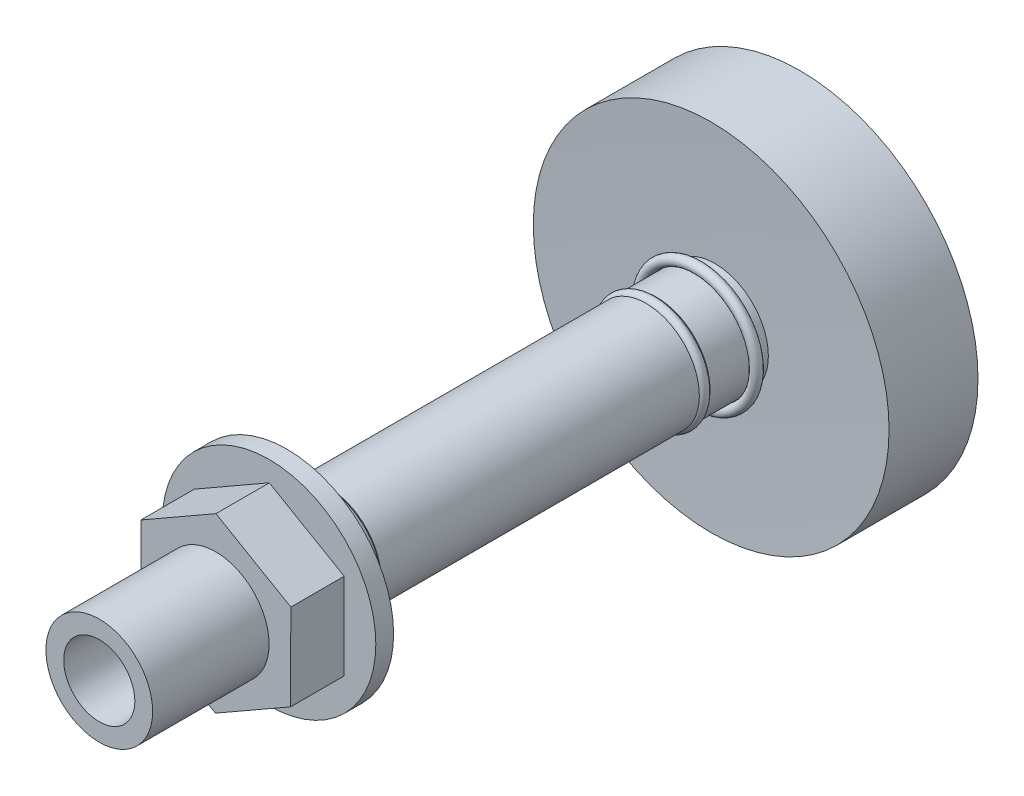
from build123d import *

# Parameters (mm, degrees)
SKETCH3_W          = 5
SKETCH3_H          = 12
SKETCH4_W          = 2
SKETCH4_H          = 3
SKETCH4_W_2        = 3
SKETCH4_H_2        = 2
SKETCH5_R          = 1.4
SKETCH6_R          = 30
CUT_EXTRUDE1_DEPTH = 15


with BuildPart() as part:
    # Sketch2 → Revolve1 (revolve)
    with BuildSketch(Plane(origin=(0, 0, 0), x_dir=(0, 0, -1), z_dir=(1, 0, 0)), mode=Mode.PRIVATE) as revolve1_sk:
        with BuildLine():
            Line((-102.306070176, 10), (-68.687078277, 10))
            Line((-68.687078277, 10), (-54.196133493, 10))
            Line((-54.196133493, 10), (-54.196133493, 5.2))
            Line((-54.196133493, 5.2), (54.694863194, 5.2))
            Line((54.694863194, 5.2), (54.694863194, 10))
            Line((54.694863194, 10), (94.694863194, 10))
            Line((94.694863194, 10), (94.694863194, 15))
            Line((94.694863194, 15), (70.768627771, 15))
            Line((70.768627771, 15), (-49.231372229, 15))
            ThreePointArc((-49.231372229, 15), (-49.372037195, 22.50063316), (-49.568967196, 30))
            Line((-49.568967196, 30), (-69.568967196, 30))
            Line((-69.568967196, 30), (-69.568967196, 15))
            Line((-69.568967196, 15), (-102.306070176, 15))
            Line((-102.306070176, 15), (-102.306070176, 10))
        make_face()
        with BuildLine():
            Line((70.768627771, 15), (94.694863194, 15))
            Line((94.694863194, 15), (94.694863194, 50))
            Line((94.694863194, 50), (69.694863194, 50))
            ThreePointArc((69.694863194, 50), (70.376280854, 32.504434199), (70.768627771, 15))
        make_face()
    revolve(revolve1_sk.sketch.rotate(Axis((0, 0, 82.888204165), (0, 0, -1)), 90), axis=Axis((0, 0, 82.888204165), (0, 0, -1)))

    # Sketch4 → Cut-Revolve1 (revolve, cut)
    with BuildSketch(Plane(origin=(0, 0, 0), x_dir=(1, 0, 0), z_dir=(0, 1, 0)), mode=Mode.PRIVATE) as cut_revolve1_sk:
        Polygon((5.184385657, 46.135301631), (7.184385374, 46.134238031), (7.184385374, 43.134238031), (5.184385657, 43.134238031), align=None)
        with Locations((6.167094919, -47.548595943)):
            Rectangle(SKETCH4_W, SKETCH4_H)
        with Locations((14.000754593, 52.877721069)):
            Rectangle(SKETCH4_W, SKETCH4_H)
        with Locations((14.008215981, -39.551570131)):
            Rectangle(SKETCH4_W, SKETCH4_H)
        with Locations((16.499787217, -56.305136806)):
            Rectangle(SKETCH4_W_2, SKETCH4_H_2)
        with Locations((16.50645373, 66.364783933)):
            Rectangle(SKETCH4_W_2, SKETCH4_H_2)
    revolve(cut_revolve1_sk.sketch.rotate(Axis((0, 0, -31.338229239), (0, 0, 1)), 90), axis=Axis((0, 0, -31.338229239), (0, 0, 1)), mode=Mode.SUBTRACT)

    # Sketch6 → Cut-Extrude1 (cut)
    with BuildSketch(Plane.XY.offset(69.568967196)):
        Circle(SKETCH6_R)
        Polygon((21.030551331, -12.230533398), (21.10722829, 12.097725009), (0.076676959, 24.328258407), (-21.030551331, 12.230533398), (-21.10722829, -12.097725009), (-0.076676959, -24.328258407), align=None, mode=Mode.SUBTRACT)
    extrude(amount=-CUT_EXTRUDE1_DEPTH, mode=Mode.SUBTRACT)


with BuildPart() as body_2:
    # Sketch3 → Revolve2 (revolve)
    with BuildSketch(Plane(origin=(0, 0, 0), x_dir=(1, 0, 0), z_dir=(0, 1, 0)), mode=Mode.PRIVATE) as revolve2_sk:
        with Locations((7.280352004, 55.48923141)):
            Rectangle(SKETCH3_W, SKETCH3_H)
        with Locations((7.437677798, -60.264530811)):
            Rectangle(SKETCH3_W, SKETCH3_H)
    revolve(revolve2_sk.sketch.rotate(Axis((0, 0, -27.02221975), (0, 0, 1)), 180), axis=Axis((0, 0, -27.02221975), (0, 0, 1)))


with BuildPart() as body_3:
    # Sketch5 → Revolve3 (revolve)
    with BuildSketch(Plane(origin=(0, 0, 0), x_dir=(1, 0, 0), z_dir=(0, 1, 0)), mode=Mode.PRIVATE) as revolve3_sk:
        with Locations((16.501027296, 65.894189595)):
            Circle(SKETCH5_R)
        with Locations((14.437473505, 52.886445358)):
            Circle(SKETCH5_R)
        with Locations((5.732191759, 44.657173232)):
            Circle(SKETCH5_R)
        with Locations((14.437473505, -39.567436543)):
            Circle(SKETCH5_R)
        with Locations((5.732191759, -47.562081473)):
            Circle(SKETCH5_R)
        with Locations((16.501027296, -55.857509039)):
            Circle(SKETCH5_R)
    revolve(revolve3_sk.sketch.rotate(Axis((0, 0, -40.610181285), (0, 0, 1)), 180), axis=Axis((0, 0, -40.610181285), (0, 0, 1)))


solid = Compound([part.part, body_2.part, body_3.part])
